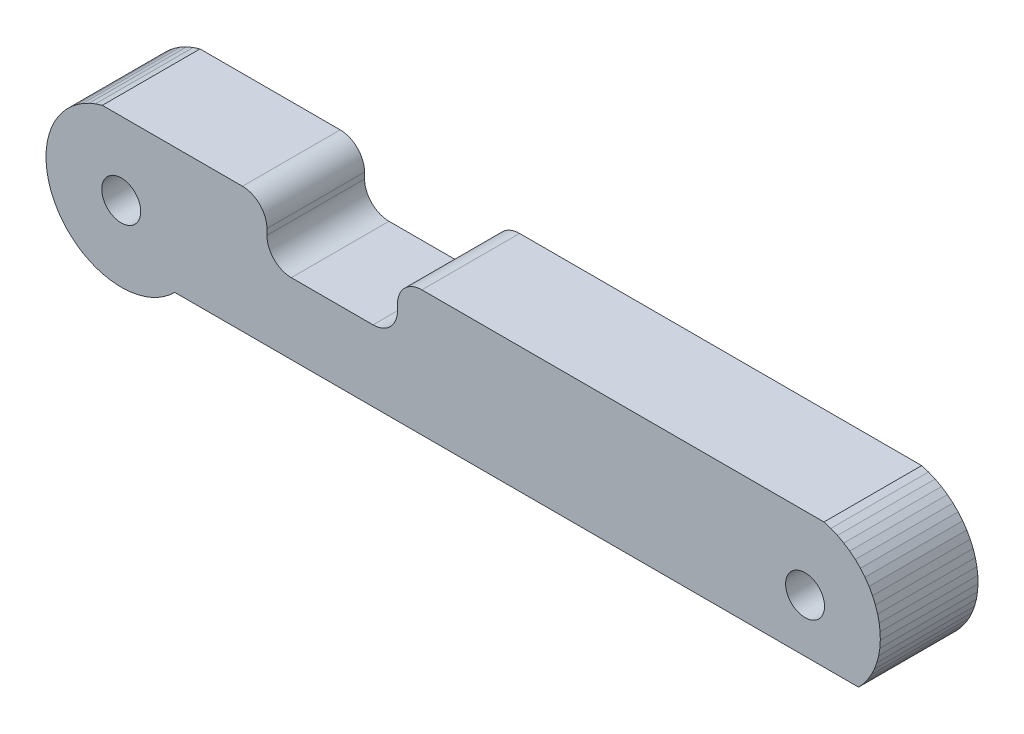
from build123d import *

# Parameters (mm, degrees)
BOSS_EXTRUDE1_DEPTH = 19.999999553
CUT_EXTRUDE1_DEPTH  = 158.443784597
CUT_EXTRUDE2_DEPTH  = 158.443784597
SKETCH7_W           = 15.825305434
SKETCH7_H           = 12.213007454
SKETCH7_W_2         = 10.489088449
SKETCH7_H_2         = 8.460664219
BOSS_EXTRUDE5_DEPTH = 20
SKETCH6_R           = 3.982936417
SKETCH6_R_2         = 3.990480896
CUT_EXTRUDE8_DEPTH  = 40
SKETCH8_W           = 26.734403149
SKETCH8_H           = 11.210794898
CUT_EXTRUDE9_DEPTH  = 30
FILLET1_R           = 5
FILLET2_R           = 5
SKETCH9_W           = 67.375066669
SKETCH9_H           = 11.734562751
CUT_EXTRUDE10_DEPTH = 8


with BuildPart() as part:
    # Sketch1 → Boss-Extrude1 (new body)
    with BuildSketch(Plane(origin=(0, 0, 0), x_dir=(-1, 0, 0), z_dir=(0, 0, -1))):
        Polygon((150.224894285, 11.525735259), (149.094194174, 12.437307276), (147.882685065, 13.238362968), (146.601140499, 13.921783306), (145.260930061, 14.481496066), (143.87395978, 14.912526123), (-3.873967333, 14.912526123), (-5.275767762, 14.476095326), (-6.629663985, 13.908221386), (-7.923361845, 13.214060105), (-9.145116434, 12.399914674), (-10.28383337, 11.473178864), (-11.329172179, 10.442265309), (-12.271642685, 9.316536598), (-13.102686033, 8.106213063), (-13.814756647, 6.822284777), (-14.401388355, 5.476410501), (-14.857255854, 4.080810118), (-15.178218484, 2.648155671), (-15.361363068, 1.191455987), (-15.405026264, -0.276062055), (-15.308812261, -1.741073444), (-15.073592775, -3.19027598), (-14.70150426, -4.610510543), (-14.195927419, -5.988881458), (-13.561449945, -7.312873378), (-12.803834863, -8.570464328), (-11.929960921, -9.750235826), (-10.947762057, -10.841473937), (129.052236676, -10.841473937), (130.121722817, -11.824152432), (131.278976798, -12.701761909), (132.513716817, -13.466504402), (133.815005422, -14.111584984), (135.171234608, -14.631270431), (136.570379138, -15.020942315), (137.999981642, -15.277140774), (139.447391033, -15.39758686), (140.899673104, -15.381210484), (142.343983054, -15.228157863), (143.767461181, -14.939788729), (145.157456398, -14.518666081), (146.501630545, -13.968531042), (147.788017988, -13.294272125), (149.00521934, -12.501881458), (150.142401457, -11.59839984), (151.189431548, -10.591856204), (152.137070894, -9.49119404), (152.976840734, -8.306192234), (153.701290488, -7.047383115), (154.303997755, -5.725951865), (154.779613018, -4.353639204), (155.123889446, -2.9426408), (155.333772302, -1.505494351), (155.407398939, -0.054970031), (155.344113708, 1.39604276), (155.144497752, 2.834650222), (154.81030941, 4.248069134), (154.344499111, 5.623740144), (153.751239181, 6.949439179), (153.035759926, 8.21338594), (152.204483747, 9.40434821), (151.264742017, 10.511744767), align=None)
    extrude(amount=-BOSS_EXTRUDE1_DEPTH)

    # Sketch2 → Cut-Extrude1 (cut, through all)
    with BuildSketch(Plane.XY.offset(19.999999553)):
        Polygon((3.729888937, 1.444966649), (3.400868736, 2.105728723), (2.956035547, 2.694782568), (2.410538495, 3.192068776), (1.78295339, 3.580653109), (1.094651991, 3.847302636), (0.369073445, 3.982936498), (-0.369073445, 3.982936498), (-1.094651991, 3.847302636), (-1.78295339, 3.580653109), (-2.410538495, 3.192068776), (-2.956035547, 2.694782568), (-3.400868736, 2.105728723), (-3.729888937, 1.444966649), (-3.93189257, 0.73499803), (-4.00000019, 0), (-3.93189257, -0.73499803), (-3.729888937, -1.444966649), (-3.400868736, -2.105728723), (-2.956035547, -2.694782568), (-2.410538495, -3.192068776), (-1.78295339, -3.580653109), (-1.094651991, -3.847302636), (-0.369073445, -3.982936498), (0.369073445, -3.982936498), (1.094651991, -3.847302636), (1.78295339, -3.580653109), (2.410538495, -3.192068776), (2.956035547, -2.694782568), (3.400868736, -2.105728723), (3.729888937, -1.444966649), (3.93189257, -0.73499803), (4.00000019, 0), (3.93189257, 0.73499803), align=None)
    extrude(amount=-CUT_EXTRUDE1_DEPTH, mode=Mode.SUBTRACT)

    # Sketch3 → Cut-Extrude2 (cut, through all)
    with BuildSketch(Plane.XY.offset(19.999999553)):
        Polygon((-139.630913734, 3.982936498), (-140.369072556, 3.982936498), (-141.094654799, 3.847302636), (-141.782954335, 3.580653109), (-142.41053164, 3.192068776), (-142.956033349, 2.694782568), (-143.400862813, 2.105728723), (-143.729895353, 1.444966649), (-143.931895494, 0.73499803), (-143.999993801, 0), (-143.931895494, -0.73499803), (-143.729895353, -1.444966649), (-143.400862813, -2.105728723), (-142.956033349, -2.694782568), (-142.41053164, -3.192068776), (-141.782954335, -3.580653109), (-141.094654799, -3.847302636), (-140.369072556, -3.982936498), (-139.630913734, -3.982936498), (-138.905346394, -3.847302636), (-138.217046857, -3.580653109), (-137.589469552, -3.192068776), (-137.043967843, -2.694782568), (-136.599138379, -2.105728723), (-136.270105839, -1.444966649), (-136.068105698, -0.73499803), (-136.000007391, 0), (-136.068105698, 0.73499803), (-136.270105839, 1.444966649), (-136.599138379, 2.105728723), (-137.043967843, 2.694782568), (-137.589469552, 3.192068776), (-138.217046857, 3.580653109), (-138.905346394, 3.847302636), align=None)
    extrude(amount=-CUT_EXTRUDE2_DEPTH, mode=Mode.SUBTRACT)

    # Sketch7 → Boss-Extrude5 (add)
    with BuildSketch(Plane.XY.offset(19.999999553)):
        with Locations((-139.666933083, -0.328537463)):
            Rectangle(SKETCH7_W, SKETCH7_H)
        with Locations((0.16180396, 0.00184402)):
            Rectangle(SKETCH7_W_2, SKETCH7_H_2)
    extrude(amount=-BOSS_EXTRUDE5_DEPTH)

    # Sketch6 → Cut-Extrude8 (cut)
    with BuildSketch(Plane(origin=(0, 0, -10), x_dir=(-1, 0, 0), z_dir=(0, 0, -1))):
        with Locations((4.82e-07, 8.1e-08)):
            Circle(SKETCH6_R)
        with Locations((140.006757016, -0.008937853)):
            Circle(SKETCH6_R_2)
    extrude(amount=-CUT_EXTRUDE8_DEPTH, mode=Mode.SUBTRACT)

    # Sketch8 → Cut-Extrude9 (cut)
    with BuildSketch(Plane.XY.offset(19.999999553)):
        with Locations((-96.813347326, 9.307128674)):
            Rectangle(SKETCH8_W, SKETCH8_H)
    extrude(amount=-CUT_EXTRUDE9_DEPTH, mode=Mode.SUBTRACT)

    # Fillet1
    fillet1_edges = [part.edges().sort_by_distance(p)[0] for p in [
        (-83.446145751, 3.701731225, 9.999999776),
        (-110.1805489, 3.701731225, 9.999999776),
    ]]
    fillet(fillet1_edges, radius=FILLET1_R)

    # Fillet2
    fillet2_edges = [part.edges().sort_by_distance(p)[0] for p in [
        (-83.446145751, 14.912526123, 9.999999776),
        (-110.1805489, 14.912526123, 9.999999776),
    ]]
    fillet(fillet2_edges, radius=FILLET2_R)

    # Sketch9 → Cut-Extrude10 (cut)
    with BuildSketch(Plane(origin=(0, 2.549240283, 0), x_dir=(-1, 0, 0), z_dir=(0, 0, -1))):
        with Locations((40.062197326, -0.800943257)):
            Rectangle(SKETCH9_W, SKETCH9_H)
    extrude(amount=-CUT_EXTRUDE10_DEPTH, mode=Mode.SUBTRACT)


solid = part.part
